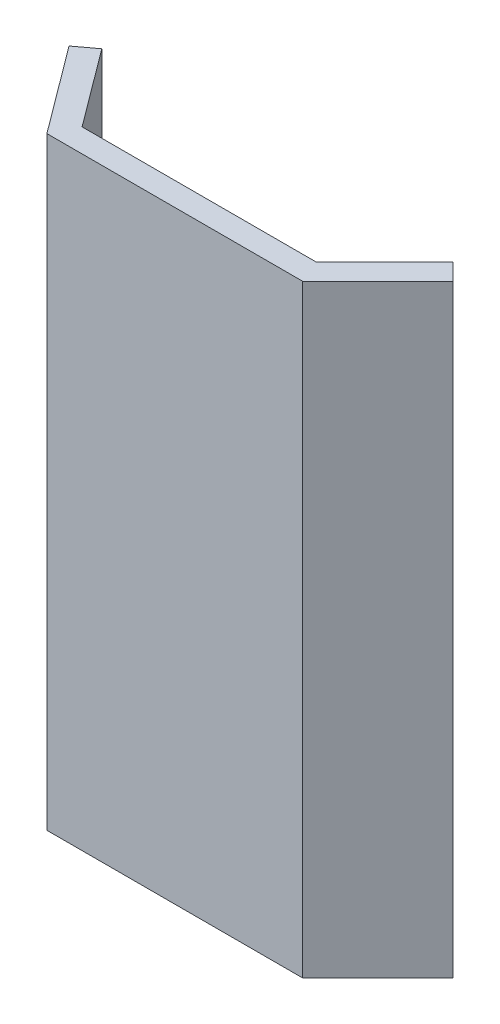
from build123d import *

# Parameters (mm, degrees)
SALIENTE_EXTRUIR1_DEPTH = 103
CROQUIS2_W              = 10
CROQUIS2_H              = 6
SALIENTE_EXTRUIR2_DEPTH = 10
CROQUIS8_R              = 1.5
CORTAR_EXTRUIR3_DEPTH   = 214.213522317


with BuildPart() as part:
    # Croquis1 → Saliente-Extruir1 (new, symmetric)
    with BuildSketch(Plane(origin=(0, 0, 0), x_dir=(1, 0, 0), z_dir=(0, 1, 0))):
        Polygon((-40, 0), (40, 0), (63.334523779, 23.334523779), (68.991378029, 17.67766953), (43.313708499, -8), (-44.015502165, -8), (-66.132956944, 21.681064581), (-59.718117141, 26.46121419), align=None)
    extrude(amount=SALIENTE_EXTRUIR1_DEPTH, both=True)

    # Croquis2 → Saliente-Extruir2 (add)
    with BuildSketch(Plane(origin=(0, 0, 0), x_dir=(-1, 0, 0), z_dir=(0, 0, -1))):
        with Locations((29, -94)):
            Rectangle(CROQUIS2_W, CROQUIS2_H)
        with Locations((-29, -94)):
            Rectangle(CROQUIS2_W, CROQUIS2_H)
    extrude(amount=SALIENTE_EXTRUIR2_DEPTH)

    # Croquis8 → Cortar-Extruir3 (cut, through all)
    with BuildSketch(Plane.XZ.offset(97)):
        with Locations(Location((29, -5, 0), (0, 0, 270))):
            Circle(CROQUIS8_R)
        with Locations(Location((-29, -5, 0), (0, 0, 270))):
            Circle(CROQUIS8_R)
    extrude(amount=-CORTAR_EXTRUIR3_DEPTH, mode=Mode.SUBTRACT)


solid = part.part
